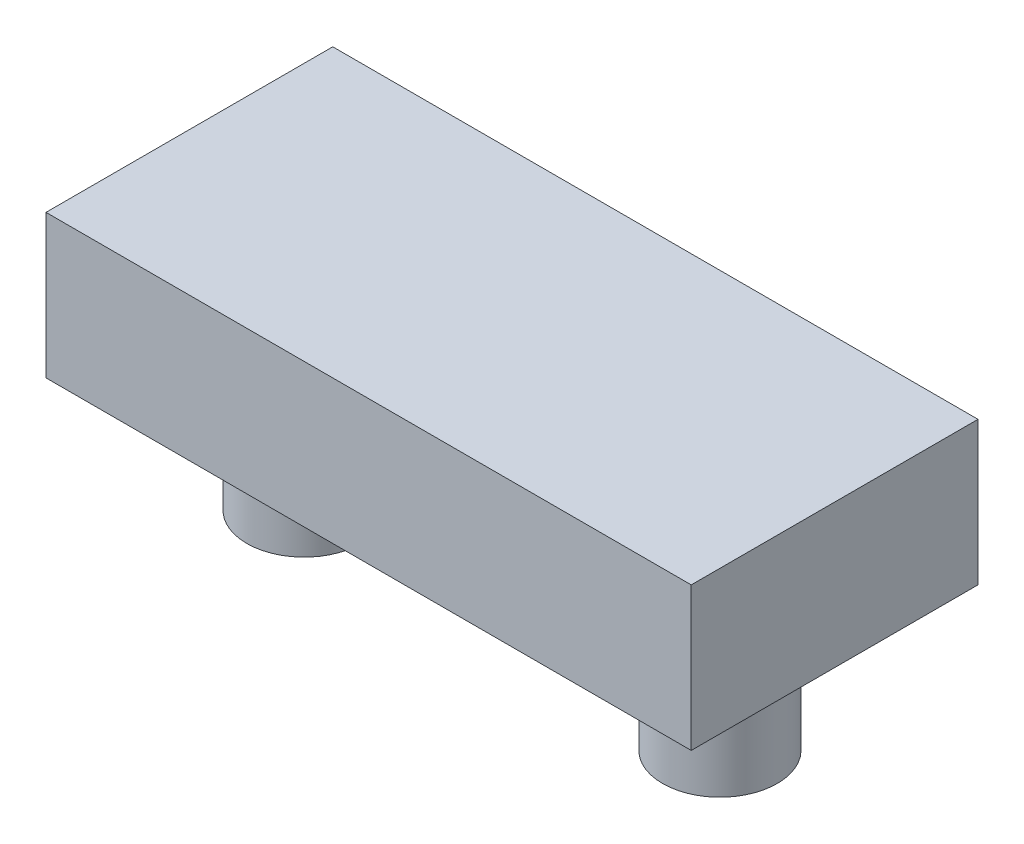
from build123d import *

# Parameters (mm, degrees)
SKETCH1_W           = 450
SKETCH1_H           = 100
BOSS_EXTRUDE1_DEPTH = 200
SKETCH2_R           = 40
BOSS_EXTRUDE2_DEPTH = 90


with BuildPart() as part:
    # Sketch1 → Boss-Extrude1 (new body)
    with BuildSketch(Plane.XY):
        with Locations((225, 590)):
            Rectangle(SKETCH1_W, SKETCH1_H)
    extrude(amount=BOSS_EXTRUDE1_DEPTH)

    # Sketch2 → Boss-Extrude2 (add)
    with BuildSketch(Plane.XZ.offset(-540)):
        with Locations(Location((80, 100, 0), (0, 0, 90))):
            Circle(SKETCH2_R)
        with Locations(Location((370, 100, 0), (0, 0, 90))):
            Circle(SKETCH2_R)
    extrude(amount=BOSS_EXTRUDE2_DEPTH)


solid = part.part
